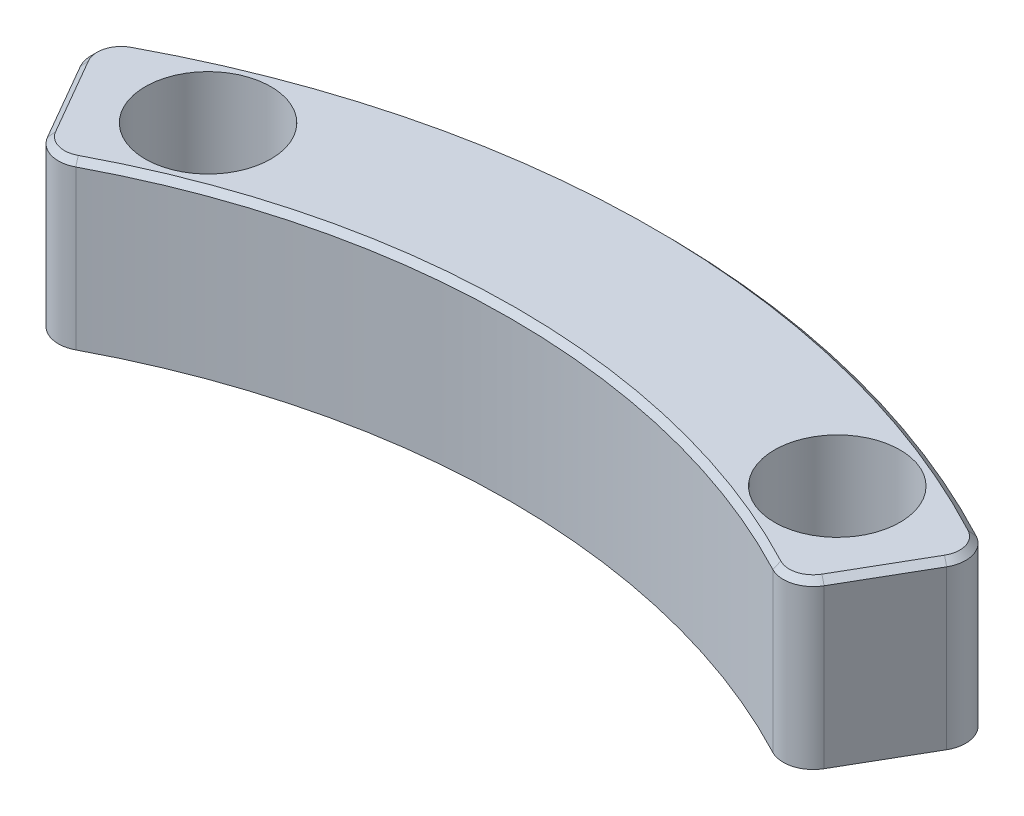
from build123d import *

# Parameters (mm, degrees)
EXTRUDE_1_DEPTH     = 5.5
SKETCH_2_R          = 2.1
CUT_EXTRUDE_2_DEPTH = 3
SKETCH_4_R          = 1.35
CUT_EXTRUDE_3_DEPTH = 7
FILLET_2_R          = 1
CHAMFER_1_SIZE      = 0.2


with BuildPart() as part:
    # 草图1 → 凸台-拉伸1 (new body)
    with BuildSketch(Plane(origin=(0, 0, 0), x_dir=(1, 0, 0), z_dir=(0, 1, 0))):
        with BuildLine():
            Line((-15, 25.980762114), (-12.5, 21.650635095))
            ThreePointArc((-12.5, 21.650635095), (0, 25), (12.5, 21.650635095))
            Line((12.5, 21.650635095), (15, 25.980762114))
            ThreePointArc((15, 25.980762114), (0, 30), (-15, 25.980762114))
        make_face()
    extrude(amount=EXTRUDE_1_DEPTH)

    # 草图2 → 切除-拉伸2 (cut)
    with BuildSketch(Plane(origin=(0, 5.5, 0), x_dir=(1, 0, 0), z_dir=(0, 1, 0))):
        with Locations(Location((-10.52379439, 25.406687144, 0), (0, 0, 270))):
            Circle(SKETCH_2_R)
        with Locations(Location((10.52379439, 25.406687144, 0), (0, 0, 270))):
            Circle(SKETCH_2_R)
    extrude(amount=-CUT_EXTRUDE_2_DEPTH, mode=Mode.SUBTRACT)

    # 草图4 → 切除-拉伸3 (cut)
    with BuildSketch(Plane(origin=(0, 5.5, 0), x_dir=(1, 0, 0), z_dir=(0, 1, 0))):
        with Locations(Location((-10.52379439, 25.406687144, 0), (0, 0, 270))):
            Circle(SKETCH_4_R)
        with Locations(Location((10.52379439, 25.406687144, 0), (0, 0, 270))):
            Circle(SKETCH_4_R)
    extrude(amount=-CUT_EXTRUDE_3_DEPTH, mode=Mode.SUBTRACT)

    # 圆角2
    fillet_2_edges = [part.edges().sort_by_distance(p)[0] for p in [
        (15, 2.75, -25.980762114),
        (12.5, 2.75, -21.650635095),
        (-12.5, 2.75, -21.650635095),
        (-15, 2.75, -25.980762114),
    ]]
    fillet(fillet_2_edges, radius=FILLET_2_R)

    # 倒角1
    chamfer_1_edges = [part.edges().sort_by_distance(p)[0] for p in [
        (0, 5.5, -30),
        (13.740878901, 5.5, -23.799900398),
        (-13.740878901, 5.5, -23.799900398),
        (0, 5.5, -25),
        (-12.401705751, 5.5, -22.039231077),
        (-14.586670486, 5.5, -25.875237728),
        (12.401705751, 5.5, -22.039231077),
        (14.586670486, 5.5, -25.875237728),
    ]]
    chamfer(chamfer_1_edges, length=CHAMFER_1_SIZE)


solid = part.part
